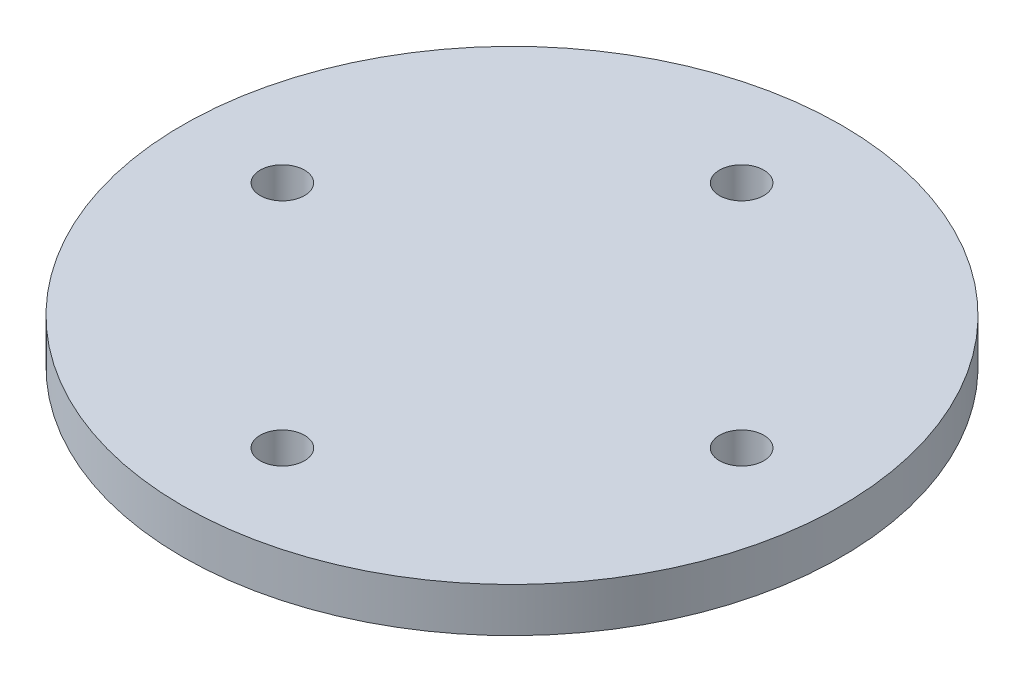
from build123d import *

# Parameters (mm, degrees)
SKETCH1_R                 = 14.875
BOSS_EXTRUDE1_DEPTH       = 2
F_2_0MM_DOWEL_HOLE1_D     = 2
F_2_0MM_DOWEL_HOLE1_DEPTH = 42.93
F_2_0MM_DOWEL_HOLE1_TIP   = 0.600860619
CHAMFER1_SIZE             = 0.5


with BuildPart() as part:
    # Sketch1 → Boss-Extrude1 (new body)
    with BuildSketch(Plane(origin=(0, 0, 0), x_dir=(1, 0, 0), z_dir=(0, 1, 0))):
        with Locations(Location((0, 0, 0), (0, 0, 270))):
            Circle(SKETCH1_R)
    extrude(amount=BOSS_EXTRUDE1_DEPTH)

    # Ø2.0mm Dowel Hole1
    with Locations(Plane(origin=(0, 2, 0), x_dir=(1, 0, 0), z_dir=(0, 1, 0))):
        with Locations((0, 10.365), (10.365, 0), (0, -10.365), (-10.365, 0)):
            Hole(F_2_0MM_DOWEL_HOLE1_D / 2, depth=F_2_0MM_DOWEL_HOLE1_DEPTH)
            with Locations((0, 0, -(F_2_0MM_DOWEL_HOLE1_DEPTH + F_2_0MM_DOWEL_HOLE1_TIP / 2))):  # 118° drill point
                Cone(0, F_2_0MM_DOWEL_HOLE1_D / 2, F_2_0MM_DOWEL_HOLE1_TIP, mode=Mode.SUBTRACT)

    # Chamfer1
    chamfer1_edges = [part.edges().sort_by_distance(p)[0] for p in [
        (1, 0, 10.365),
        (11.365, 0, 0),
        (1, 0, -10.365),
        (-9.365, 0, 0),
    ]]
    chamfer(chamfer1_edges, length=CHAMFER1_SIZE)


solid = part.part
